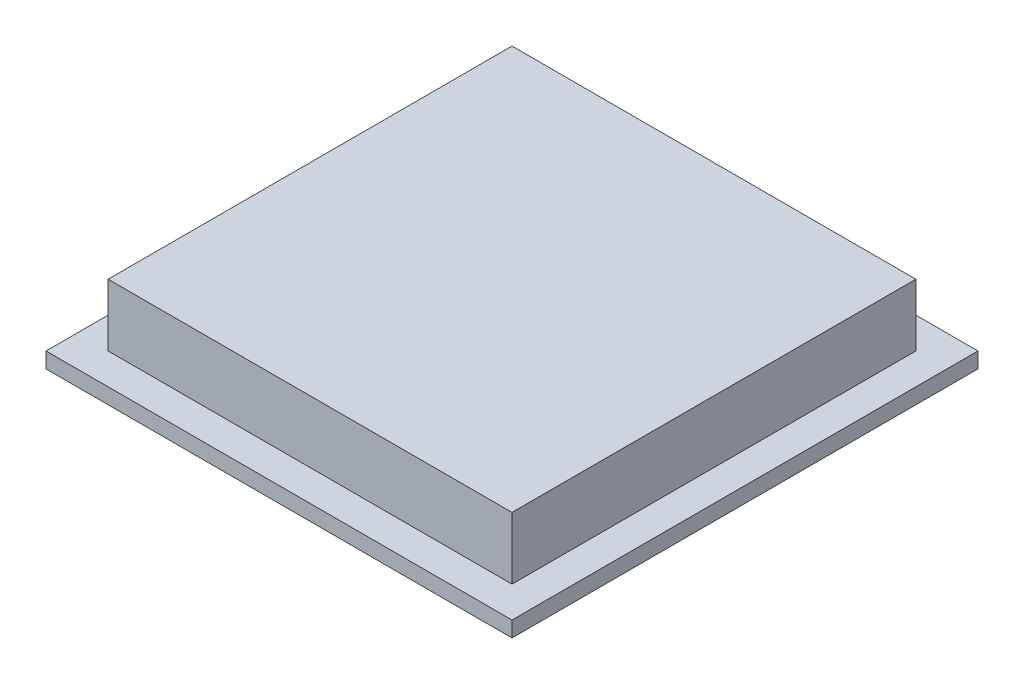
from build123d import *

# Parameters (mm, degrees)
SKETCH1_W           = 38.1
SKETCH1_H           = 38.1
BOSS_EXTRUDE1_DEPTH = 6.35
SKETCH2_W           = 33.02
SKETCH2_H           = 33.02
CUT_EXTRUDE1_DEPTH  = 5.08
SKETCH5_R           = 10.755
CUT_EXTRUDE5_DEPTH  = 5.08
FILLET7_R           = 2.032
FILLET8_R           = 2.032


with BuildPart() as part:
    # Sketch1 → Boss-Extrude1 (new body)
    with BuildSketch(Plane(origin=(0, 0, 0), x_dir=(1, 0, 0), z_dir=(0, 1, 0))):
        Rectangle(SKETCH1_W, SKETCH1_H)
    extrude(amount=BOSS_EXTRUDE1_DEPTH)

    # Sketch2 → Cut-Extrude1 (cut)
    with BuildSketch(Plane(origin=(0, 6.35, 0), x_dir=(1, 0, 0), z_dir=(0, 1, 0))):
        Polygon((-16.51, 19.05), (-19.05, 19.05), (-19.05, 16.51), (-19.05, -16.51), (-19.05, -19.05), (-16.51, -19.05), (16.51, -19.05), (19.05, -19.05), (19.05, -16.51), (19.05, 16.51), (19.05, 19.05), (16.51, 19.05), align=None)
        Rectangle(SKETCH2_W, SKETCH2_H, mode=Mode.SUBTRACT)
    extrude(amount=-CUT_EXTRUDE1_DEPTH, mode=Mode.SUBTRACT)

    # Sketch5 → Cut-Extrude5 (cut)
    with BuildSketch(Plane.XZ):
        with Locations(Location((0, 0, 0), (0, 0, 270))):
            Circle(SKETCH5_R)
    extrude(amount=-CUT_EXTRUDE5_DEPTH, mode=Mode.SUBTRACT)

    # Fillet7
    fillet7_edges = [part.edges().sort_by_distance(p)[0] for p in [
        (0, 5.08, 10.755),
    ]]
    fillet(fillet7_edges, radius=FILLET7_R)

    # Fillet8
    fillet8_edges = [part.edges().sort_by_distance(p)[0] for p in [
        (0, 0, 10.755),
    ]]
    fillet(fillet8_edges, radius=FILLET8_R)


solid = part.part
